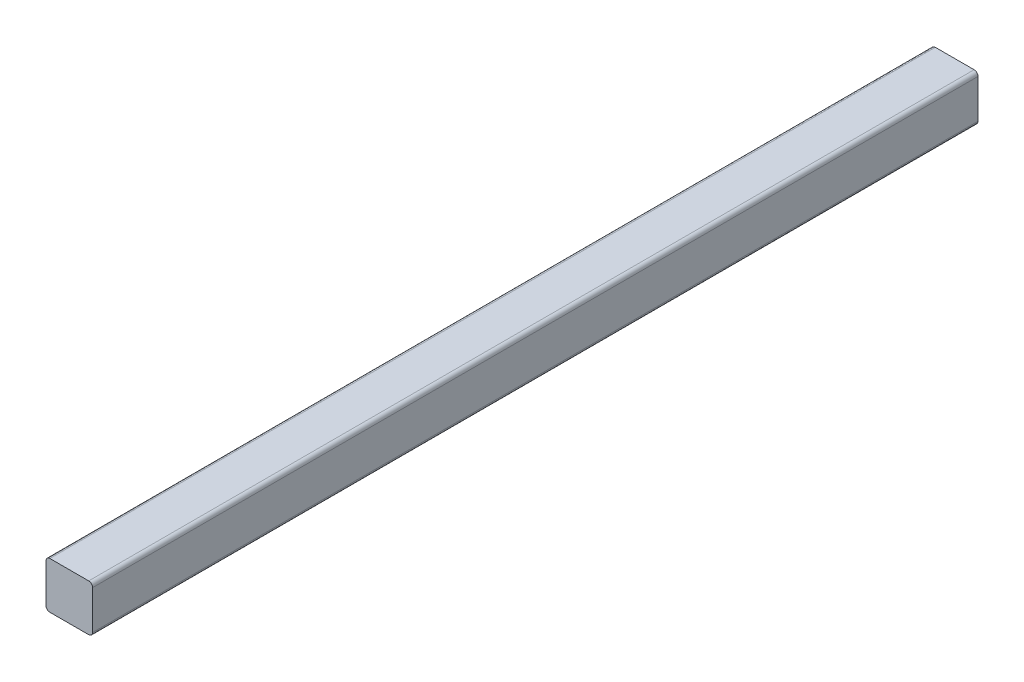
from build123d import *

# Parameters (mm, degrees)
SKETCH1_W           = 38.1
SKETCH1_H           = 38.1
BOSS_EXTRUDE1_DEPTH = 723.9
FILLET1_R           = 3.175


with BuildPart() as part:
    # Sketch1 → Boss-Extrude1 (new body)
    with BuildSketch(Plane.XY):
        Rectangle(SKETCH1_W, SKETCH1_H)
    extrude(amount=BOSS_EXTRUDE1_DEPTH)

    # Fillet1
    fillet1_edges = [part.edges().sort_by_distance(p)[0] for p in [
        (19.05, -19.05, 361.95),
        (-19.05, -19.05, 361.95),
        (-19.05, 19.05, 361.95),
        (19.05, 19.05, 361.95),
    ]]
    fillet(fillet1_edges, radius=FILLET1_R)


solid = part.part
